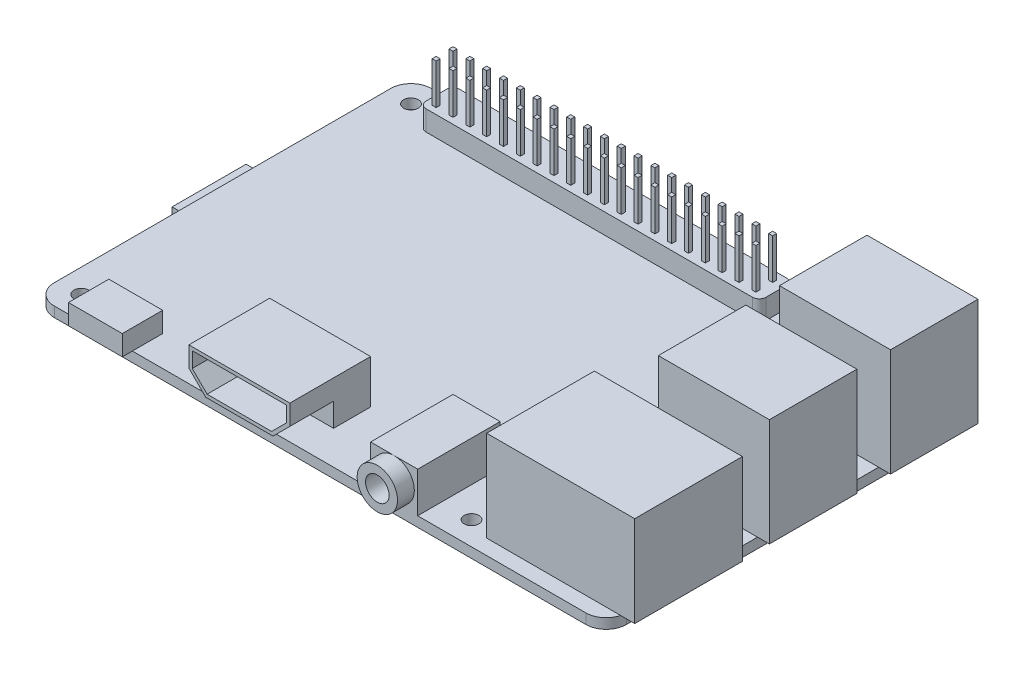
from build123d import *

# Parameters (mm, degrees)
SKETCH1_W           = 85
SKETCH1_H           = 56
SKETCH1_R           = 2.647058824
SKETCH1_R_2         = 1.094711895
BOSS_EXTRUDE1_DEPTH = 1.5
FILLET1_R           = 3
SKETCH2_W           = 15
SKETCH2_H           = 12
BOSS_EXTRUDE2_DEPTH = 6.5
CUT_EXTRUDE1_DEPTH  = 6.5
SKETCH4_W           = 16.5
SKETCH4_H           = 13
BOSS_EXTRUDE3_DEPTH = 16
SKETCH5_W           = 22
SKETCH5_H           = 16
BOSS_EXTRUDE4_DEPTH = 13.5
SKETCH6_W           = 7
SKETCH6_H           = 14.75
BOSS_EXTRUDE5_DEPTH = 6
SKETCH7_R           = 1.75
CUT_EXTRUDE2_DEPTH  = 2.5
SKETCH8_W           = 8
SKETCH8_H           = 6
BOSS_EXTRUDE6_DEPTH = 3
SKETCH9_W           = 50.5
SKETCH9_H           = 5
BOSS_EXTRUDE7_DEPTH = 3
FILLET2_R           = 1
SKETCH10_W          = 0.6
SKETCH10_H          = 0.6
BOSS_EXTRUDE8_DEPTH = 6
SKETCH11_W          = 15.5
SKETCH11_H          = 11
BOSS_EXTRUDE9_DEPTH = 1.5


with BuildPart() as part:
    # Sketch1 → Boss-Extrude1 (new body)
    # profile 1 of 5: a face of its own
    with BuildSketch(Plane(origin=(0, 0, 0), x_dir=(1, 0, 0), z_dir=(0, 1, 0))):
        Rectangle(SKETCH1_W, SKETCH1_H)
        with Locations((-39, -24.5)):
            Circle(SKETCH1_R, mode=Mode.SUBTRACT)
        with Locations((19, -24.5)):
            Circle(SKETCH1_R, mode=Mode.SUBTRACT)
        with Locations((19, 24.5)):
            Circle(SKETCH1_R, mode=Mode.SUBTRACT)
        with Locations((-39, 24.5)):
            Circle(SKETCH1_R, mode=Mode.SUBTRACT)
    # profile 2 of 5: a face of its own
    with BuildSketch(Plane(origin=(0, 0, 0), x_dir=(1, 0, 0), z_dir=(0, 1, 0))):
        with Locations((19, -24.5)):
            Circle(SKETCH1_R)
        with Locations(Location((19, -24.5, 0), (0, 0, 270))):
            Circle(SKETCH1_R_2, mode=Mode.SUBTRACT)
    # profile 3 of 5: a face of its own
    with BuildSketch(Plane(origin=(0, 0, 0), x_dir=(1, 0, 0), z_dir=(0, 1, 0))):
        with Locations((-39, -24.5)):
            Circle(SKETCH1_R)
        with Locations(Location((-39, -24.5, 0), (0, 0, 270))):
            Circle(SKETCH1_R_2, mode=Mode.SUBTRACT)
    # profile 4 of 5: a face of its own
    with BuildSketch(Plane(origin=(0, 0, 0), x_dir=(1, 0, 0), z_dir=(0, 1, 0))):
        with Locations((-39, 24.5)):
            Circle(SKETCH1_R)
        with Locations(Location((-39, 24.5, 0), (0, 0, 270))):
            Circle(SKETCH1_R_2, mode=Mode.SUBTRACT)
    # profile 5 of 5: a face of its own
    with BuildSketch(Plane(origin=(0, 0, 0), x_dir=(1, 0, 0), z_dir=(0, 1, 0))):
        with Locations((19, 24.5)):
            Circle(SKETCH1_R)
        with Locations(Location((19, 24.5, 0), (0, 0, 270))):
            Circle(SKETCH1_R_2, mode=Mode.SUBTRACT)
    extrude(amount=BOSS_EXTRUDE1_DEPTH)

    # Fillet1
    fillet1_edges = [part.edges().sort_by_distance(p)[0] for p in [
        (42.5, 0.75, 28),
        (-42.5, 0.75, 28),
        (-42.5, 0.75, -28),
        (42.5, 0.75, -28),
    ]]
    fillet(fillet1_edges, radius=FILLET1_R)

    # Sketch2 → Boss-Extrude2 (add)
    with BuildSketch(Plane(origin=(0, 1.5, 0), x_dir=(1, 0, 0), z_dir=(0, 1, 0))):
        with Locations((-10.5, -23.5)):
            Rectangle(SKETCH2_W, SKETCH2_H)
    extrude(amount=BOSS_EXTRUDE2_DEPTH)

    # Sketch3 → Cut-Extrude1 (cut)
    with BuildSketch(Plane.XY.offset(29.5)):
        Polygon((-10.5, 3), (-10.5, 7.5), (-17.5, 7.5), (-17.5, 5.207106781), (-15.292893219, 3), align=None)
        Polygon((-3.5, 7.5), (-10.5, 7.5), (-10.5, 3), (-5.707106781, 3), (-3.5, 5.207106781), align=None)
        Polygon((-10.5, 1.5), (-10.5, 2.5), (-15.5, 2.5), (-18, 5), (-18, 1.5), align=None)
        Polygon((-5.5, 2.5), (-10.5, 2.5), (-10.5, 1.5), (-3, 1.5), (-3, 5), align=None)
    extrude(amount=-CUT_EXTRUDE1_DEPTH, mode=Mode.SUBTRACT)

    # Sketch4 → Boss-Extrude3 (add)
    with BuildSketch(Plane(origin=(0, 1.5, 0), x_dir=(1, 0, 0), z_dir=(0, 1, 0))):
        with Locations((36.015178625, 19)):
            Rectangle(SKETCH4_W, SKETCH4_H)
        with Locations((36.015178625, 1)):
            Rectangle(SKETCH4_W, SKETCH4_H)
    extrude(amount=BOSS_EXTRUDE3_DEPTH)

    # Sketch5 → Boss-Extrude4 (add)
    with BuildSketch(Plane(origin=(0, 1.5, 0), x_dir=(1, 0, 0), z_dir=(0, 1, 0))):
        with Locations((33.5, -17.75)):
            Rectangle(SKETCH5_W, SKETCH5_H)
    extrude(amount=BOSS_EXTRUDE4_DEPTH)

    # Sketch6 → Boss-Extrude5 (add)
    with BuildSketch(Plane(origin=(0, 1.5, 0), x_dir=(1, 0, 0), z_dir=(0, 1, 0))):
        with Locations((11, -23.125)):
            Rectangle(SKETCH6_W, SKETCH6_H)
    extrude(amount=BOSS_EXTRUDE5_DEPTH)

    # Sketch7 → Cut-Extrude2 (cut)
    with BuildSketch(Plane.XY.offset(30.5)):
        with BuildLine():
            ThreePointArc((8, 4.5), (8.878679656, 6.621320344), (11, 7.5))
            Line((11, 7.5), (7.5, 7.5))
            Line((7.5, 7.5), (7.5, 4.5))
            Line((7.5, 4.5), (8, 4.5))
        make_face()
        with BuildLine():
            Line((14, 4.5), (14.5, 4.5))
            Line((14.5, 4.5), (14.5, 7.5))
            Line((14.5, 7.5), (11, 7.5))
            ThreePointArc((11, 7.5), (13.121320344, 6.621320344), (14, 4.5))
        make_face()
        with BuildLine():
            Line((14.5, 1.5), (14.5, 4.5))
            Line((14.5, 4.5), (14, 4.5))
            ThreePointArc((14, 4.5), (13.121320344, 2.378679656), (11, 1.5))
            Line((11, 1.5), (14.5, 1.5))
        make_face()
        with BuildLine():
            Line((7.5, 1.5), (11, 1.5))
            ThreePointArc((11, 1.5), (8.878679656, 2.378679656), (8, 4.5))
            Line((8, 4.5), (7.5, 4.5))
            Line((7.5, 4.5), (7.5, 1.5))
        make_face()
        with Locations((11, 4.5)):
            Circle(SKETCH7_R)
    extrude(amount=-CUT_EXTRUDE2_DEPTH, mode=Mode.SUBTRACT)

    # Sketch8 → Boss-Extrude6 (add)
    with BuildSketch(Plane(origin=(0, 1.5, 0), x_dir=(1, 0, 0), z_dir=(0, 1, 0))):
        with Locations((-31.9, -26.5)):
            Rectangle(SKETCH8_W, SKETCH8_H)
    extrude(amount=BOSS_EXTRUDE6_DEPTH)

    # Sketch9 → Boss-Extrude7 (add)
    with BuildSketch(Plane(origin=(0, 1.5, 0), x_dir=(1, 0, 0), z_dir=(0, 1, 0))):
        with Locations((-10, 24.5)):
            Rectangle(SKETCH9_W, SKETCH9_H)
    extrude(amount=BOSS_EXTRUDE7_DEPTH)

    # Fillet2
    fillet2_edges = [part.edges().sort_by_distance(p)[0] for p in [
        (-35.25, 3, -27),
        (-35.25, 3, -22),
        (15.25, 3, -22),
        (15.25, 3, -27),
    ]]
    fillet(fillet2_edges, radius=FILLET2_R)

    # Sketch10 → Boss-Extrude8 (add)
    with BuildSketch(Plane(origin=(0, 4.5, 0), x_dir=(1, 0, 0), z_dir=(0, 1, 0))):
        with Locations((-33.95, 25.7)):
            Rectangle(SKETCH10_W, SKETCH10_H)
        with Locations((-31.45, 25.7)):
            Rectangle(SKETCH10_W, SKETCH10_H)
        with Locations((-28.95, 25.7)):
            Rectangle(SKETCH10_W, SKETCH10_H)
        with Locations((-26.45, 25.7)):
            Rectangle(SKETCH10_W, SKETCH10_H)
        with Locations((-23.95, 25.7)):
            Rectangle(SKETCH10_W, SKETCH10_H)
        with Locations((-21.45, 25.7)):
            Rectangle(SKETCH10_W, SKETCH10_H)
        with Locations((-18.95, 25.7)):
            Rectangle(SKETCH10_W, SKETCH10_H)
        with Locations((-16.45, 25.7)):
            Rectangle(SKETCH10_W, SKETCH10_H)
        with Locations((-13.95, 25.7)):
            Rectangle(SKETCH10_W, SKETCH10_H)
        with Locations((-11.45, 25.7)):
            Rectangle(SKETCH10_W, SKETCH10_H)
        with Locations((-8.95, 25.7)):
            Rectangle(SKETCH10_W, SKETCH10_H)
        with Locations((-6.45, 25.7)):
            Rectangle(SKETCH10_W, SKETCH10_H)
        with Locations((-3.95, 25.7)):
            Rectangle(SKETCH10_W, SKETCH10_H)
        with Locations((-1.45, 25.7)):
            Rectangle(SKETCH10_W, SKETCH10_H)
        with Locations((1.05, 25.7)):
            Rectangle(SKETCH10_W, SKETCH10_H)
        with Locations((3.55, 25.7)):
            Rectangle(SKETCH10_W, SKETCH10_H)
        with Locations((6.05, 25.7)):
            Rectangle(SKETCH10_W, SKETCH10_H)
        with Locations((8.55, 25.7)):
            Rectangle(SKETCH10_W, SKETCH10_H)
        with Locations((11.05, 25.7)):
            Rectangle(SKETCH10_W, SKETCH10_H)
        with Locations((13.55, 25.7)):
            Rectangle(SKETCH10_W, SKETCH10_H)
        with Locations((-31.45, 23.2)):
            Rectangle(SKETCH10_W, SKETCH10_H)
        with Locations((-28.95, 23.2)):
            Rectangle(SKETCH10_W, SKETCH10_H)
        with Locations((-26.45, 23.2)):
            Rectangle(SKETCH10_W, SKETCH10_H)
        with Locations((-23.95, 23.2)):
            Rectangle(SKETCH10_W, SKETCH10_H)
        with Locations((-21.45, 23.2)):
            Rectangle(SKETCH10_W, SKETCH10_H)
        with Locations((-18.95, 23.2)):
            Rectangle(SKETCH10_W, SKETCH10_H)
        with Locations((-16.45, 23.2)):
            Rectangle(SKETCH10_W, SKETCH10_H)
        with Locations((-13.95, 23.2)):
            Rectangle(SKETCH10_W, SKETCH10_H)
        with Locations((-11.45, 23.2)):
            Rectangle(SKETCH10_W, SKETCH10_H)
        with Locations((-8.95, 23.2)):
            Rectangle(SKETCH10_W, SKETCH10_H)
        with Locations((-6.45, 23.2)):
            Rectangle(SKETCH10_W, SKETCH10_H)
        with Locations((-3.95, 23.2)):
            Rectangle(SKETCH10_W, SKETCH10_H)
        with Locations((-1.45, 23.2)):
            Rectangle(SKETCH10_W, SKETCH10_H)
        with Locations((1.05, 23.2)):
            Rectangle(SKETCH10_W, SKETCH10_H)
        with Locations((3.55, 23.2)):
            Rectangle(SKETCH10_W, SKETCH10_H)
        with Locations((6.05, 23.2)):
            Rectangle(SKETCH10_W, SKETCH10_H)
        with Locations((8.55, 23.2)):
            Rectangle(SKETCH10_W, SKETCH10_H)
        with Locations((11.05, 23.2)):
            Rectangle(SKETCH10_W, SKETCH10_H)
        with Locations((13.55, 23.2)):
            Rectangle(SKETCH10_W, SKETCH10_H)
        with Locations((-33.95, 23.2)):
            Rectangle(SKETCH10_W, SKETCH10_H)
    extrude(amount=BOSS_EXTRUDE8_DEPTH)

    # Sketch11 → Boss-Extrude9 (add)
    with BuildSketch(Plane.XZ):
        with Locations((-37.25, -0.5)):
            Rectangle(SKETCH11_W, SKETCH11_H)
    extrude(amount=BOSS_EXTRUDE9_DEPTH)


solid = part.part
